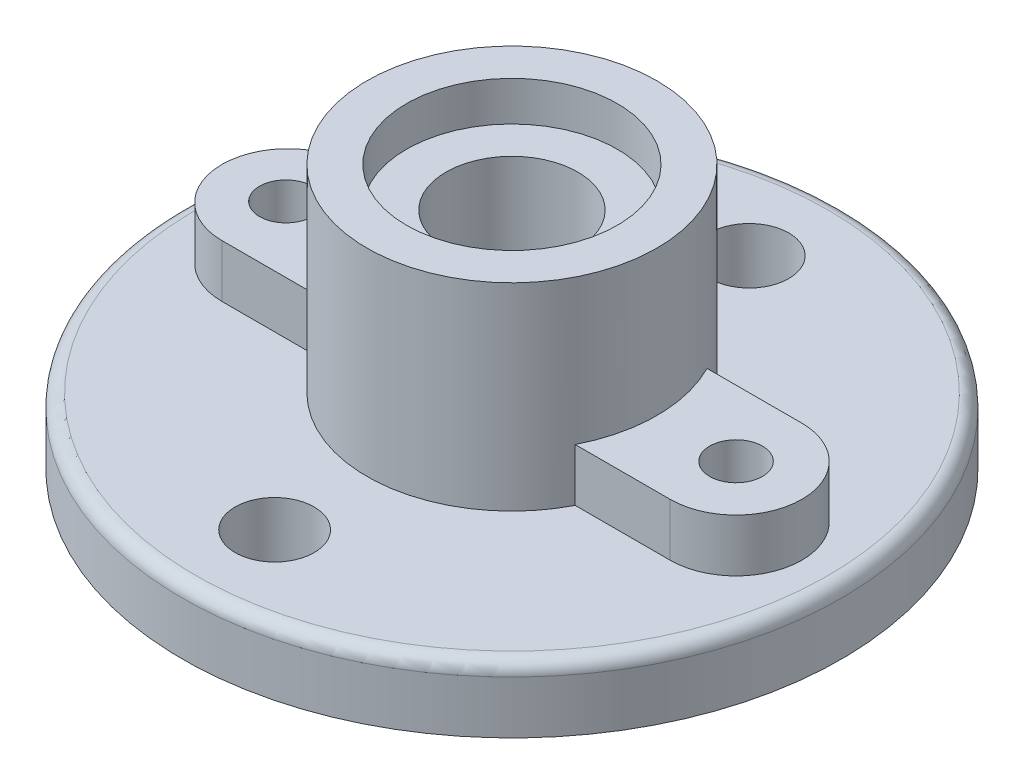
from build123d import *

# Parameters (mm, degrees)
EXTRUDE_2_DEPTH     = 9
SKETCH_4_R          = 2
SKETCH_4_R_2        = 3
CUT_EXTRUDE_1_DEPTH = 9
FILLET_1_R          = 1


with BuildPart() as part:
    # 草圖1 → 旋轉1 (revolve)
    with BuildSketch(Plane.XY, mode=Mode.PRIVATE) as revolve_1_sk:
        Polygon((25, 0), (0, 0), (0, 20), (11, 20), (11, 5), (25, 5), align=None)
    revolve(revolve_1_sk.sketch.rotate(Axis((0, 0, 0), (0, 1, 0)), 90), axis=Axis((0, 0, 0), (0, 1, 0)))

    # 草圖2 → 除料-旋轉1 (revolve, cut)
    with BuildSketch(Plane.XY, mode=Mode.PRIVATE) as cut_revolve_1_sk:
        Polygon((0, 20), (0, 0), (5, 0), (5, 17), (8, 17), (8, 20), align=None)
    revolve(cut_revolve_1_sk.sketch.rotate(Axis((0, 20, 0), (0, -1, 0)), 90), axis=Axis((0, 20, 0), (0, -1, 0)), mode=Mode.SUBTRACT)

    # 草圖3 → 填料-伸長2 (add)
    with BuildSketch(Plane(origin=(0, 0, 0), x_dir=(1, 0, 0), z_dir=(0, 1, 0))):
        with BuildLine():
            Line((-17, 5), (-9.797958971, 5))
            Line((-9.797958971, 5), (-9.797958971, -5))
            Line((-9.797958971, -5), (-17, -5))
            ThreePointArc((-17, -5), (-22, 0), (-17, 5))
        make_face()
        with BuildLine():
            Line((9.797958971, 5), (9.797958971, -5))
            Line((9.797958971, -5), (17, -5))
            ThreePointArc((17, -5), (22, 0), (17, 5))
            Line((17, 5), (9.797958971, 5))
        make_face()
    extrude(amount=EXTRUDE_2_DEPTH)

    # 草圖4 → 除料-伸長1 (cut)
    with BuildSketch(Plane(origin=(0, 0, 0), x_dir=(1, 0, 0), z_dir=(0, 1, 0))):
        with Locations(Location((-17.142374929, 0, 0), (0, 0, 270))):
            Circle(SKETCH_4_R)
        with Locations(Location((17, 0, 0), (0, 0, 270))):
            Circle(SKETCH_4_R)
        with Locations(Location((0, 18, 0), (0, 0, 90))):
            Circle(SKETCH_4_R_2)
        with Locations(Location((0, -18, 0), (0, 0, 90))):
            Circle(SKETCH_4_R_2)
    extrude(amount=CUT_EXTRUDE_1_DEPTH, mode=Mode.SUBTRACT)

    # 圓角1
    fillet_1_edges = [part.edges().sort_by_distance(p)[0] for p in [
        (0, 5, 25),
    ]]
    fillet(fillet_1_edges, radius=FILLET_1_R)


solid = part.part
